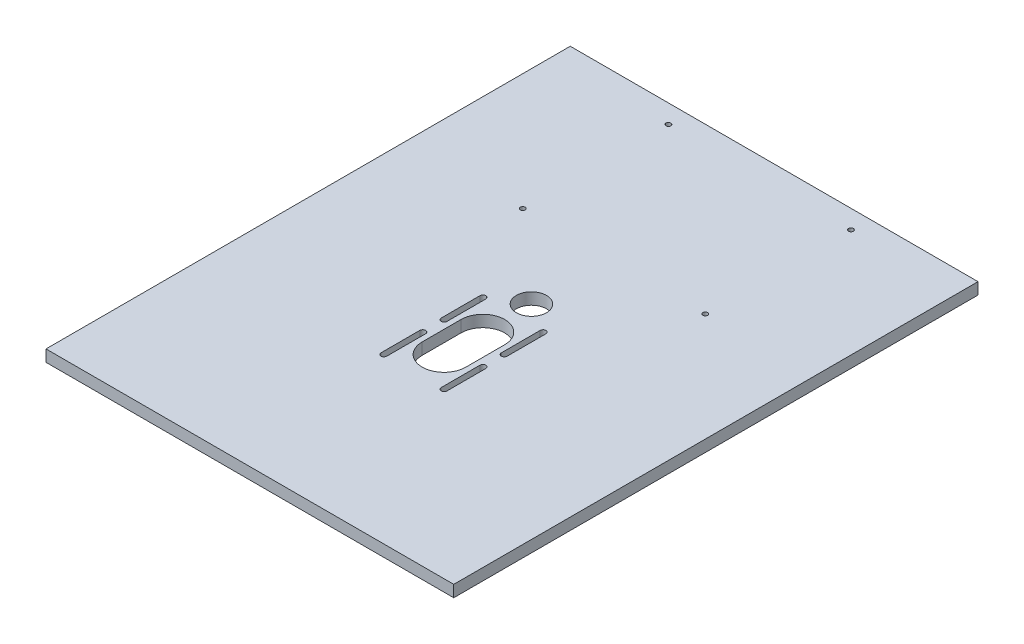
from build123d import *

# Parameters (mm, degrees)
SKETCH1_W           = 210
SKETCH1_H           = 270
SKETCH1_R           = 7.75
BOSS_EXTRUDE2_DEPTH = 6
CUT_EXTRUDE1_DEPTH  = 10
SKETCH4_R           = 1.25
CUT_EXTRUDE2_DEPTH  = 10


with BuildPart() as part:
    # Sketch1 → Boss-Extrude2 (new body)
    with BuildSketch(Plane(origin=(0, 0, 0), x_dir=(1, 0, 0), z_dir=(0, 1, 0))):
        with Locations((0, -10)):
            Rectangle(SKETCH1_W, SKETCH1_H)
        with Locations(Location((0, 0, 0), (0, 0, 270))):
            Circle(SKETCH1_R, mode=Mode.SUBTRACT)
    extrude(amount=BOSS_EXTRUDE2_DEPTH)

    # Sketch3 → Cut-Extrude1 (cut)
    with BuildSketch(Plane.XZ):
        with BuildLine():
            Line((17.000022153, 29.5), (17.000022153, 9.5))
            ThreePointArc((17.000022153, 9.5), (15.500022153, 8), (14.000022153, 9.5))
            Line((14.000022153, 9.5), (14.000022153, 29.5))
            ThreePointArc((14.000022153, 29.5), (15.500022153, 31), (17.000022153, 29.5))
        make_face()
        with BuildLine():
            Line((17.000022153, 60.5), (17.000022153, 40.5))
            ThreePointArc((17.000022153, 40.5), (15.500022153, 39), (14.000022153, 40.5))
            Line((14.000022153, 40.5), (14.000022153, 60.5))
            ThreePointArc((14.000022153, 60.5), (15.500022153, 62), (17.000022153, 60.5))
        make_face()
        with BuildLine():
            Line((-16.999993108, 29.500016738), (-17.0000128, 9.500016738))
            ThreePointArc((-17.0000128, 9.500016738), (-15.500014277, 8.000015261), (-14.0000128, 9.500013784))
            Line((-14.0000128, 9.500013784), (-13.999993108, 29.500013784))
            ThreePointArc((-13.999993108, 29.500013784), (-15.499991631, 31.000015261), (-16.999993108, 29.500016738))
        make_face()
        with BuildLine():
            Line((-16.999962586, 60.500016738), (-16.999982277, 40.500016738))
            ThreePointArc((-16.999982277, 40.500016738), (-15.499983754, 39.000015261), (-13.999982277, 40.500013784))
            Line((-13.999982277, 40.500013784), (-13.999962586, 60.500013784))
            ThreePointArc((-13.999962586, 60.500013784), (-15.499961109, 62.000015261), (-16.999962586, 60.500016738))
        make_face()
        with BuildLine():
            Line((11.250022153, 44.999994462), (11.250012307, 24.999994462))
            ThreePointArc((11.250012307, 24.999994462), (6.769e-06, 13.75), (-11.249987693, 25.000005538))
            Line((-11.249987693, 25.000005538), (-11.249977847, 45.000005538))
            ThreePointArc((-11.249977847, 45.000005538), (2.7692e-05, 56.25), (11.250022153, 44.999994462))
        make_face()
    extrude(amount=-CUT_EXTRUDE1_DEPTH, mode=Mode.SUBTRACT)

    # Sketch4 → Cut-Extrude2 (cut)
    with BuildSketch(Plane.XZ):
        with Locations(Location((49.170333674, -115.382230576, 0), (0, 0, 270))):
            Circle(SKETCH4_R)
        with Locations(Location((-44.829666326, -115.382230576, 0), (0, 0, 270))):
            Circle(SKETCH4_R)
        with Locations(Location((49.170333674, -40.382230576, 0), (0, 0, 270))):
            Circle(SKETCH4_R)
        with Locations(Location((-44.829666326, -40.382230576, 0), (0, 0, 270))):
            Circle(SKETCH4_R)
    extrude(amount=-CUT_EXTRUDE2_DEPTH, mode=Mode.SUBTRACT)


solid = part.part
